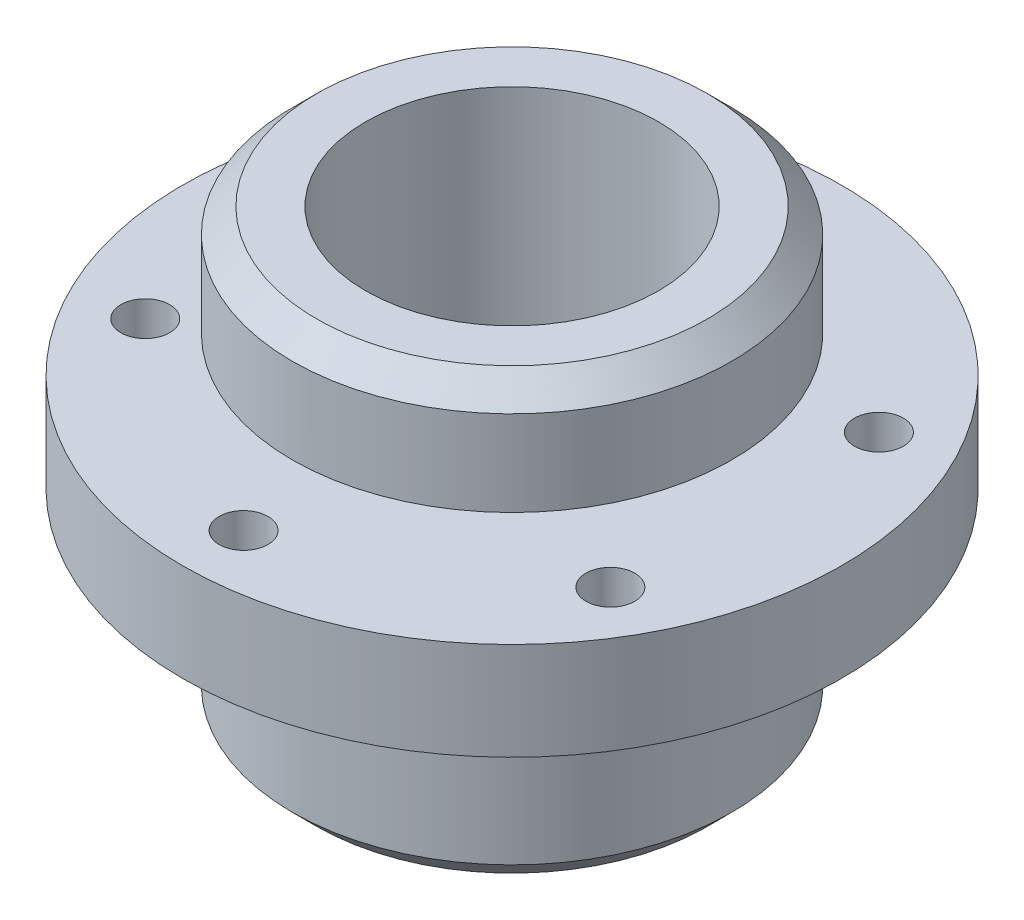
from build123d import *

# Parameters (mm, degrees)
SKETCH2_R          = 4
CUT_EXTRUDE1_DEPTH = 16
CIRPATTERN1_COUNT  = 6
CHAMFER1_SIZE      = 4
CHAMFER2_SIZE      = 4
FILLET1_R          = 4
FILLET2_R          = 4


with BuildPart() as part:
    # Sketch1 → Revolve1 (revolve)
    with BuildSketch(Plane.XY, mode=Mode.PRIVATE) as revolve1_sk:
        Polygon((24, -46.7154047), (36, -46.7154047), (36, -22.7154047), (27.164490862, -22.7154047), (27.164490862, -14.7154047), (54, -14.7154047), (54, 1.2845953), (27.164490862, 1.2845953), (27.164490862, 7.2845953), (36, 7.2845953), (36, 25.2845953), (24, 25.2845953), align=None)
    revolve(revolve1_sk.sketch.rotate(Axis((0, 63.408022787, 0), (0, -1, 0)), 90), axis=Axis((0, 63.408022787, 0), (0, -1, 0)))

    # Sketch2 → Cut-Extrude1 (cut)
    with BuildSketch(Plane(origin=(0, 1.2845953, 0), x_dir=(1, 0, 0), z_dir=(0, 1, 0))):
        with Locations(Location((0, 44, 0), (0, 0, 270))):
            Circle(SKETCH2_R)
    cut_extrude1 = extrude(amount=-CUT_EXTRUDE1_DEPTH, mode=Mode.SUBTRACT)

    # CirPattern1: Cut-Extrude1 ×6 about axis
    cirpattern1_axis = Axis((0, 0, 0), (0, 1, 0))
    for i in range(1, CIRPATTERN1_COUNT):
        add(cut_extrude1.rotate(cirpattern1_axis, i * 360 / CIRPATTERN1_COUNT), mode=Mode.SUBTRACT)

    # Chamfer1
    chamfer1_edges = [part.edges().sort_by_distance(p)[0] for p in [
        (0, 25.2845953, -36),
    ]]
    chamfer(chamfer1_edges, length=CHAMFER1_SIZE)

    # Chamfer2
    chamfer2_edges = [part.edges().sort_by_distance(p)[0] for p in [
        (0, -46.7154047, -36),
    ]]
    chamfer(chamfer2_edges, length=CHAMFER2_SIZE)

    # Fillet1
    fillet1_edges = [part.edges().sort_by_distance(p)[0] for p in [
        (0, -22.7154047, -27.164490862),
    ]]
    fillet(fillet1_edges, radius=FILLET1_R)

    # Fillet2
    fillet2_edges = [part.edges().sort_by_distance(p)[0] for p in [
        (0, 7.2845953, -27.164490862),
    ]]
    fillet(fillet2_edges, radius=FILLET2_R)


solid = part.part
